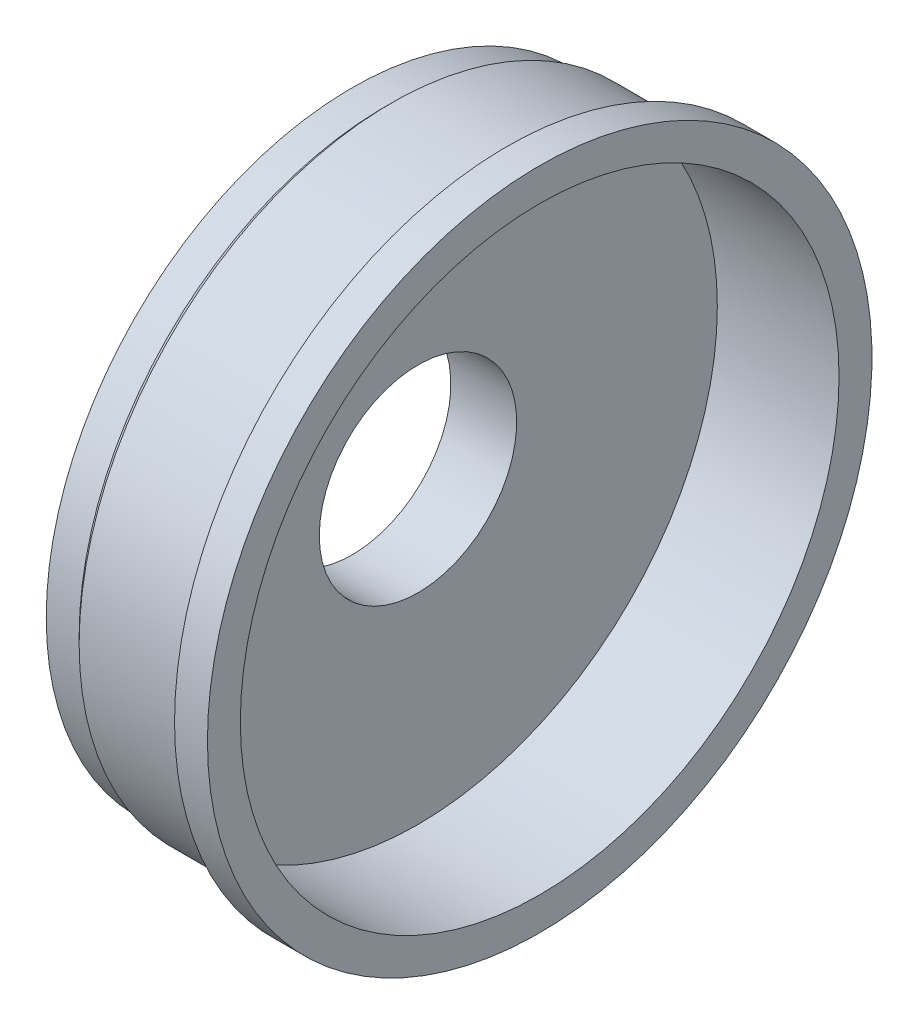
from build123d import *


with BuildPart() as part:
    # Sketch1 → Revolve1 (revolve)
    with BuildSketch(Plane.XY, mode=Mode.PRIVATE) as revolve1_sk:
        Polygon((-14.9225, 9.525), (-8.5725, 9.525), (-8.5725, 28.8925), (3.175, 28.8925), (3.175, 32.0675), (0, 32.0675), (0, 30.1625), (-11.1125, 30.1625), (-11.7475, 29.5275), (-14.9225, 29.5275), align=None)
    revolve(revolve1_sk.sketch.rotate(Axis((0, 0, 0), (1, 0, 0)), 90), axis=Axis((0, 0, 0), (1, 0, 0)))


solid = part.part
